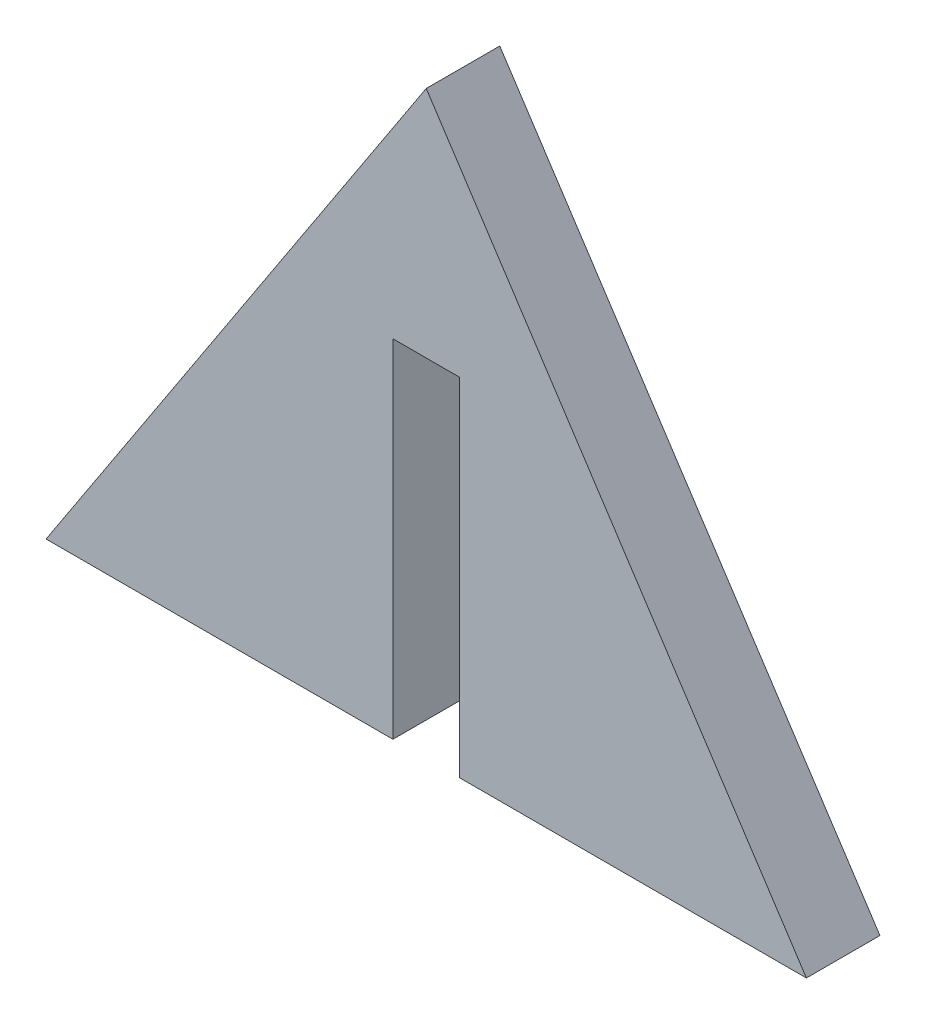
from build123d import *

# Parameters (mm, degrees)
BOSS_EXTRUDE1_DEPTH = 2.6924


with BuildPart() as part:
    # Sketch1 → Boss-Extrude1 (new body)
    with BuildSketch(Plane.XY):
        Polygon((-13.9192, 6.439545569), (0, 27.686095203), (13.9192, 6.439545569), (1.2192, 6.439545569), (1.2192, 19.139545569), (-1.2192, 19.139545569), (-1.2192, 6.439545569), align=None)
    extrude(amount=BOSS_EXTRUDE1_DEPTH)


solid = part.part
